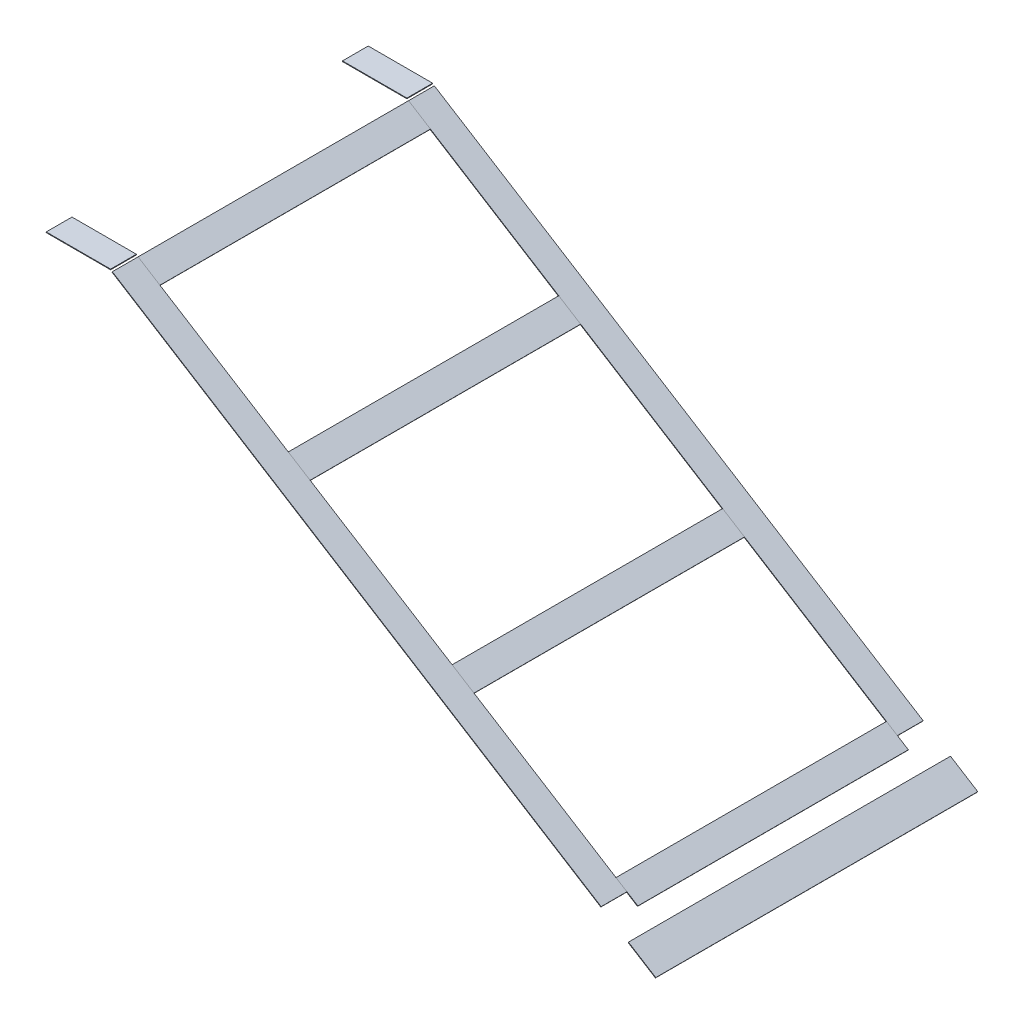
from build123d import *

# Parameters (mm, degrees)
RAIL_SEAT_1_EPDM_T1_DEPTH     = 40
SKETCH_2_W                    = 100
SKETCH_2_H                    = 1
PLATFORM_SEAT_1_EPDM_T1_DEPTH = 40
RAIL_SEAT_2_EPDM_T1_START     = 460
RAIL_SEAT_2_EPDM_T1_DEPTH     = 40
PLATFORM_SEAT_2_EPDM_T1_START = 460
SKETCH_4_W                    = 100
SKETCH_4_H                    = 1
PLATFORM_SEAT_2_EPDM_T1_DEPTH = 40
TOE_SEAT_EPDM_T1_DEPTH        = 500
CROSS_SEAT_S25_EPDM_T1_START  = 40
CROSS_SEAT_S25_EPDM_T1_DEPTH  = 420
CROSS_SEAT_S300_EPDM_T1_START = 40
CROSS_SEAT_S300_EPDM_T1_DEPTH = 420
CROSS_SEAT_S600_EPDM_T1_START = 40
CROSS_SEAT_S600_EPDM_T1_DEPTH = 420
CROSS_SEAT_S900_EPDM_T1_START = 40
CROSS_SEAT_S900_EPDM_T1_DEPTH = 420


with BuildPart() as part:
    # 草图1 → Rail_seat_1_EPDM_t1 (new body)
    with BuildSketch(Plane.XY):
        Polygon((152.650482688, 557.558387489), (911.653528748, 83.280646), (911.123609484, 82.432597904), (152.120563424, 556.710339393), align=None)
    extrude(amount=RAIL_SEAT_1_EPDM_T1_DEPTH)


with BuildPart() as body_2:
    # 草图2 → Platform_seat_1_EPDM_t1 (new body)
    with BuildSketch(Plane.XY):
        with Locations((100, 559.252128099)):
            Rectangle(SKETCH_2_W, SKETCH_2_H)
    extrude(amount=PLATFORM_SEAT_1_EPDM_T1_DEPTH)


with BuildPart() as body_3:
    # 草图3 → Rail_seat_2_EPDM_t1 (new body)
    with BuildSketch(Plane.XY.offset(RAIL_SEAT_2_EPDM_T1_START)):
        Polygon((152.650482688, 557.558387489), (911.653528748, 83.280646), (911.123609484, 82.432597904), (152.120563424, 556.710339393), align=None)
    extrude(amount=RAIL_SEAT_2_EPDM_T1_DEPTH)


with BuildPart() as body_4:
    # 草图4 → Platform_seat_2_EPDM_t1 (new body)
    with BuildSketch(Plane.XY.offset(PLATFORM_SEAT_2_EPDM_T1_START)):
        with Locations((100, 559.252128099)):
            Rectangle(SKETCH_4_W, SKETCH_4_H)
    extrude(amount=PLATFORM_SEAT_2_EPDM_T1_DEPTH)


with BuildPart() as body_5:
    # 草图5 → Toe_seat_EPDM_t1 (new body)
    with BuildSketch(Plane.XY):
        Polygon((954.055933556, 56.784682789), (996.458338364, 30.288719577), (995.928419099, 29.440671481), (953.526014292, 55.936634693), align=None)
    extrude(amount=TOE_SEAT_EPDM_T1_DEPTH)


with BuildPart() as body_6:
    # 草图6 → Cross_seat_s25_EPDM_t1 (new body)
    with BuildSketch(Plane.XY.offset(CROSS_SEAT_S25_EPDM_T1_START)):
        Polygon((152.650482688, 557.558387489), (186.572406534, 536.36161692), (186.04248727, 535.513568824), (152.120563424, 556.710339393), align=None)
    extrude(amount=CROSS_SEAT_S25_EPDM_T1_DEPTH)


with BuildPart() as body_7:
    # 草图7 → Cross_seat_s300_EPDM_t1 (new body)
    with BuildSketch(Plane.XY.offset(CROSS_SEAT_S300_EPDM_T1_START)):
        Polygon((385.863709131, 411.830589825), (419.785632977, 390.633819256), (419.255713713, 389.785771159), (385.333789867, 410.982541729), align=None)
    extrude(amount=CROSS_SEAT_S300_EPDM_T1_DEPTH)


with BuildPart() as body_8:
    # 草图8 → Cross_seat_s600_EPDM_t1 (new body)
    with BuildSketch(Plane.XY.offset(CROSS_SEAT_S600_EPDM_T1_START)):
        Polygon((640.278137978, 252.854810555), (674.200061824, 231.658039986), (673.67014256, 230.80999189), (639.748218714, 252.006762459), align=None)
    extrude(amount=CROSS_SEAT_S600_EPDM_T1_DEPTH)


with BuildPart() as body_9:
    # 草图9 → Cross_seat_s900_EPDM_t1 (new body)
    with BuildSketch(Plane.XY.offset(CROSS_SEAT_S900_EPDM_T1_START)):
        Polygon((894.692566825, 93.879031285), (928.614490671, 72.682260716), (928.084571407, 71.83421262), (894.162647561, 93.030983189), align=None)
    extrude(amount=CROSS_SEAT_S900_EPDM_T1_DEPTH)


solid = Compound([part.part, body_2.part, body_3.part, body_4.part, body_5.part, body_6.part, body_7.part, body_8.part, body_9.part])
